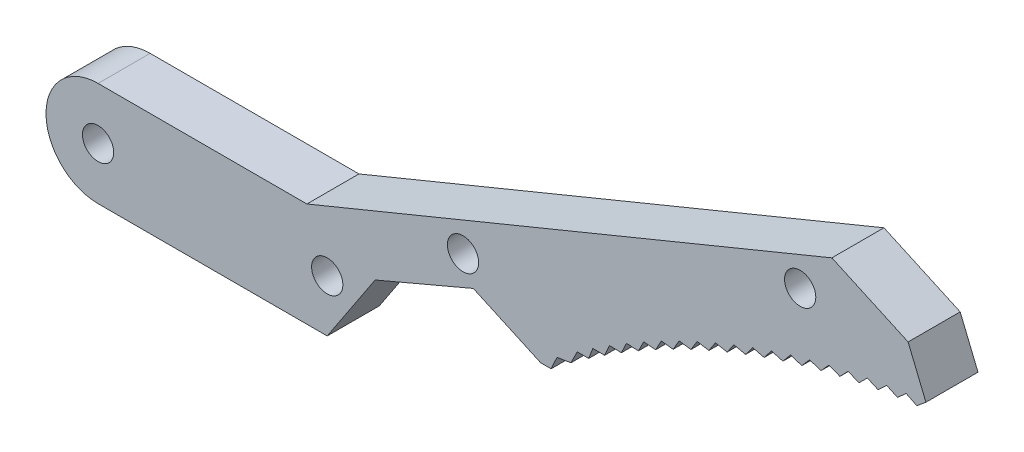
from build123d import *

# Parameters (mm, degrees)
SKETCH_1_R      = 1.5
EXTRUDE_1_DEPTH = 5


with BuildPart() as part:
    # 스케치1 → 보스-돌출1 (new body)
    with BuildSketch(Plane.XY):
        with BuildLine():
            Line((20.05, 5), (0, 5))
            ThreePointArc((0, 5), (-5, 0), (0, -5))
            Line((0, -5), (22, -5))
            Line((22, -5), (26.601353767, 1.956410875))
            Line((26.601353767, 1.956410875), (36.025134241, 5.963228766))
            Line((36.025134241, 5.963228766), (42.488975113, 3.018953392))
            Line((42.488975113, 3.018953392), (43.498164032, 3.018953392))
            Line((43.498164032, 3.018953392), (44.062133892, 4.253931713))
            Line((44.062133892, 4.253931713), (45.402427297, 4.470373499))
            Line((45.402427297, 4.470373499), (46.008680673, 5.685153438))
            Line((46.008680673, 5.685153438), (47.107948843, 5.685153438))
            Line((47.107948843, 5.685153438), (47.498446434, 6.712724429))
            Line((47.498446434, 6.712724429), (48.640951743, 6.712724429))
            Line((48.640951743, 6.712724429), (49.103035082, 7.757615508))
            Line((49.103035082, 7.757615508), (50.245112942, 7.726365831))
            Line((50.245112942, 7.726365831), (50.735603144, 8.758227131))
            Line((50.735603144, 8.758227131), (51.876398977, 8.69575116))
            Line((51.876398977, 8.69575116), (52.394929025, 9.713810574))
            Line((52.394929025, 9.713810574), (53.533589213, 9.620155058))
            Line((53.533589213, 9.620155058), (54.079771108, 10.623650806))
            Line((54.079771108, 10.623650806), (55.215443631, 10.498885825))
            Line((55.215443631, 10.498885825), (55.788868685, 11.487067026))
            Line((55.788868685, 11.487067026), (56.920703758, 11.331285936))
            Line((56.920703758, 11.331285936), (57.520942896, 12.303413169))
            Line((57.520942896, 12.303413169), (58.648093605, 12.116732536))
            Line((58.648093605, 12.116732536), (59.274697688, 13.072078391))
            Line((59.274697688, 13.072078391), (60.396320625, 12.854637901))
            Line((60.396320625, 12.854637901), (61.048820788, 13.792487525))
            Line((61.048820788, 13.792487525), (62.164076682, 13.544449883))
            Line((62.164076682, 13.544449883), (62.84198468, 14.464101515))
            Line((62.84198468, 14.464101515), (63.950039022, 14.185652318))
            Line((63.950039022, 14.185652318), (64.652847601, 15.086417815))
            Line((64.652847601, 15.086417815), (65.752871272, 14.777765417))
            Line((65.752871272, 14.777765417), (66.480054544, 15.658970767))
            Line((66.480054544, 15.658970767), (67.571224435, 15.320346122))
            Line((67.571224435, 15.320346122), (68.322238273, 16.181331949))
            Line((68.322238273, 16.181331949), (69.403737898, 15.812988438))
            Line((69.403737898, 15.812988438), (70.165521035, 16.650113087))
            Line((70.165521035, 16.650113087), (71.224188399, 16.249719983))
            Line((71.224188399, 16.249719983), (72.008283749, 17.065983242))
            Line((72.008283749, 17.065983242), (73.055761076, 16.637168043))
            Line((73.055761076, 16.637168043), (73.861597574, 17.431975419))
            Line((73.861597574, 17.431975419), (74.897121975, 16.975050435))
            Line((74.897121975, 16.975050435), (75.724112721, 17.74782306))
            Line((75.724112721, 17.74782306), (76.746930013, 17.263121075))
            Line((76.746930013, 17.263121075), (77.594472701, 18.013296132))
            Line((77.594472701, 18.013296132), (78.603837954, 17.501170159))
            Line((78.603837954, 17.501170159), (79.484104239, 18.229489901))
            Line((79.484104239, 18.229489901), (77.772918882, 22.391441928))
            Line((77.772918882, 22.391441928), (70.455863435, 25.724355994))
            Line((70.455863435, 25.724355994), (20.05, 5))
        make_face()
        with Locations((35.039512437, 8.36046215)):
            Circle(SKETCH_1_R, mode=Mode.SUBTRACT)
        Circle(SKETCH_1_R, mode=Mode.SUBTRACT)
        with Locations((22, 0)):
            Circle(SKETCH_1_R, mode=Mode.SUBTRACT)
        with Locations((67.410250422, 21.669681595)):
            Circle(SKETCH_1_R, mode=Mode.SUBTRACT)
    extrude(amount=EXTRUDE_1_DEPTH)


solid = part.part
